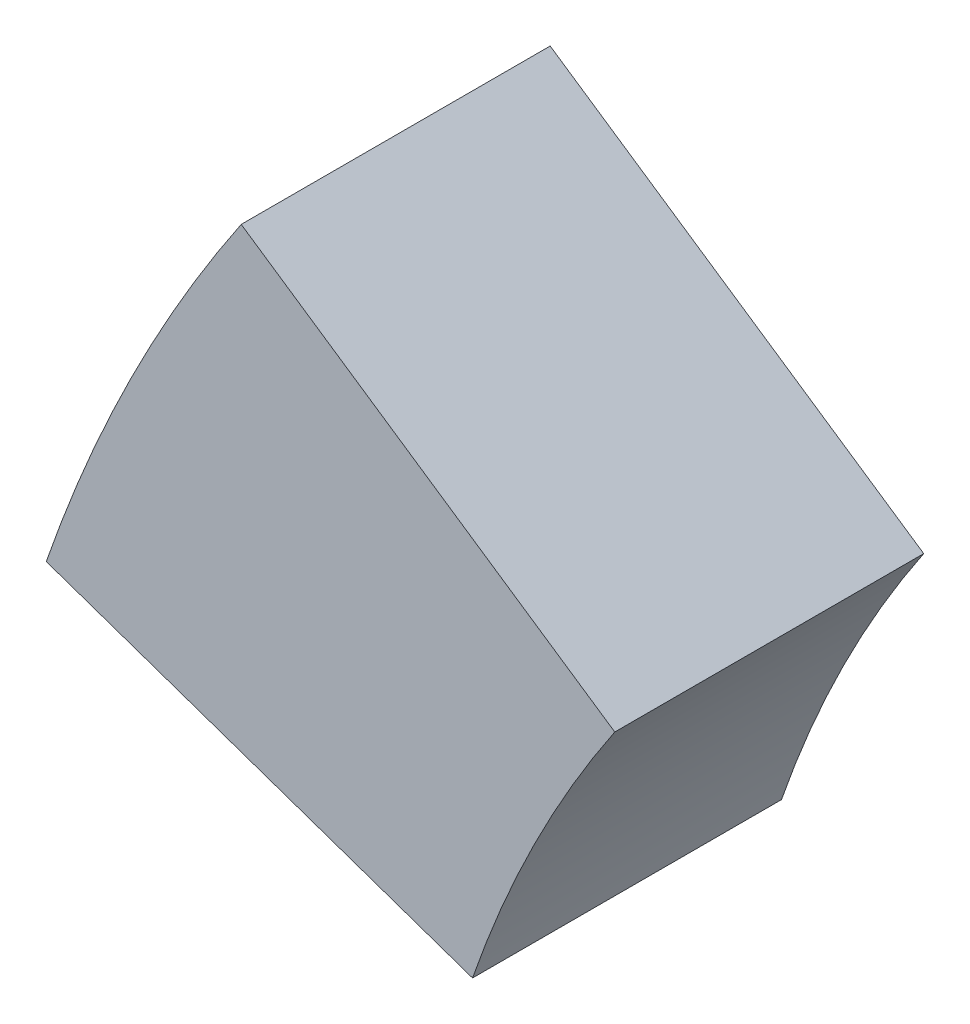
from build123d import *

# Parameters (mm, degrees)
RESSALTO_EXTRUS_O1_DEPTH = 50


with BuildPart() as part:
    # Esboço1 → Ressalto-extrusão1 (new body)
    with BuildSketch(Plane.XY):
        with BuildLine():
            Line((-223.603883097, 151.331766209), (-163.148018408, 110.41614053))
            ThreePointArc((-163.148018408, 110.41614053), (-176.164462877, 88.17642553), (-186.166684544, 64.427987442))
            Line((-186.166684544, 64.427987442), (-255.152308766, 88.302317814))
            ThreePointArc((-255.152308766, 88.302317814), (-241.443680085, 120.850938544), (-223.603883097, 151.331766209))
        make_face()
    extrude(amount=RESSALTO_EXTRUS_O1_DEPTH)


solid = part.part
